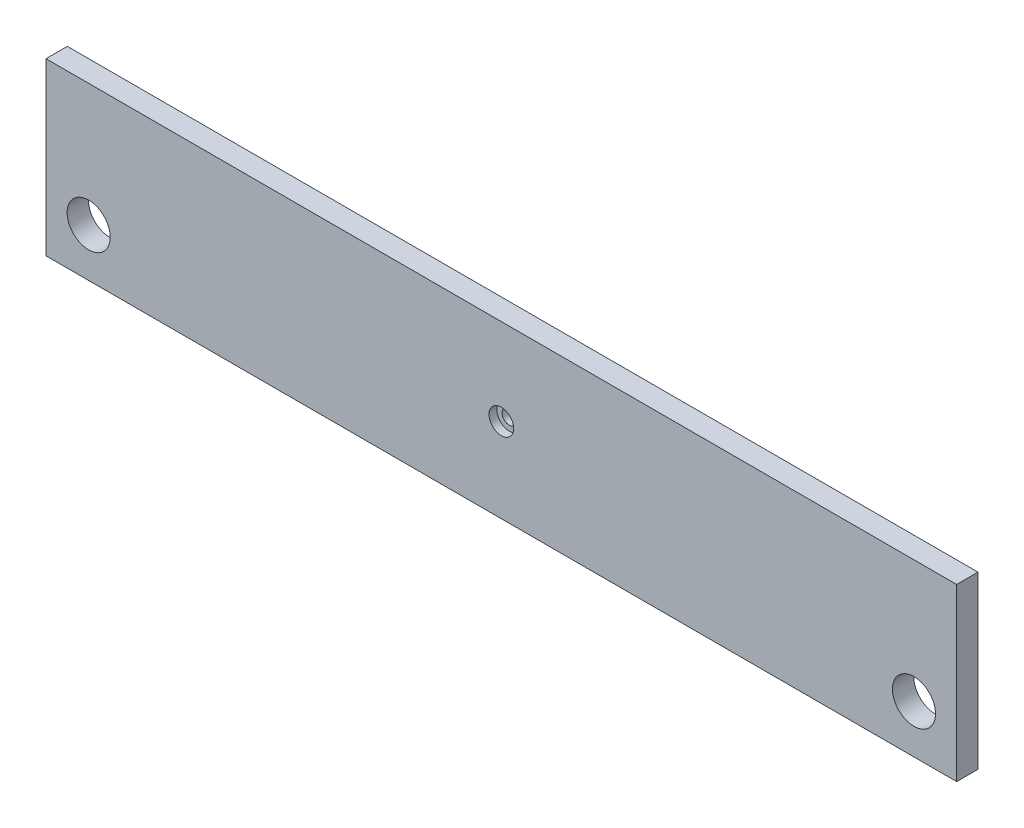
from build123d import *

# Parameters (mm, degrees)
SKETCH1_W           = 812.8
SKETCH1_H           = 152.4
BOSS_EXTRUDE1_DEPTH = 19.05
SKETCH2_R           = 19.2405
CUT_EXTRUDE1_DEPTH  = 19.05
SKETCH3_R           = 10.9982
CUT_EXTRUDE2_DEPTH  = 6.985
SKETCH4_R           = 6.35
CUT_EXTRUDE3_DEPTH  = 828.052092812


with BuildPart() as part:
    # Sketch1 → Boss-Extrude1 (new body)
    with BuildSketch(Plane.XY):
        with Locations((406.4, 76.2)):
            Rectangle(SKETCH1_W, SKETCH1_H)
    extrude(amount=BOSS_EXTRUDE1_DEPTH)

    # Sketch2 → Cut-Extrude1 (cut)
    with BuildSketch(Plane.XY.offset(19.05)):
        with Locations((38.1, 42.926)):
            Circle(SKETCH2_R)
        with Locations((774.7, 42.926)):
            Circle(SKETCH2_R)
    extrude(amount=-CUT_EXTRUDE1_DEPTH, mode=Mode.SUBTRACT)

    # Sketch3 → Cut-Extrude2 (cut)
    with BuildSketch(Plane.XY.offset(19.05)):
        with Locations((406.4, 75.2094)):
            Circle(SKETCH3_R)
    extrude(amount=-CUT_EXTRUDE2_DEPTH, mode=Mode.SUBTRACT)

    # Sketch4 → Cut-Extrude3 (cut, through all)
    with BuildSketch(Plane.XY.offset(12.065)):
        with Locations((406.4, 75.2094)):
            Circle(SKETCH4_R)
    extrude(amount=-CUT_EXTRUDE3_DEPTH, mode=Mode.SUBTRACT)


solid = part.part
